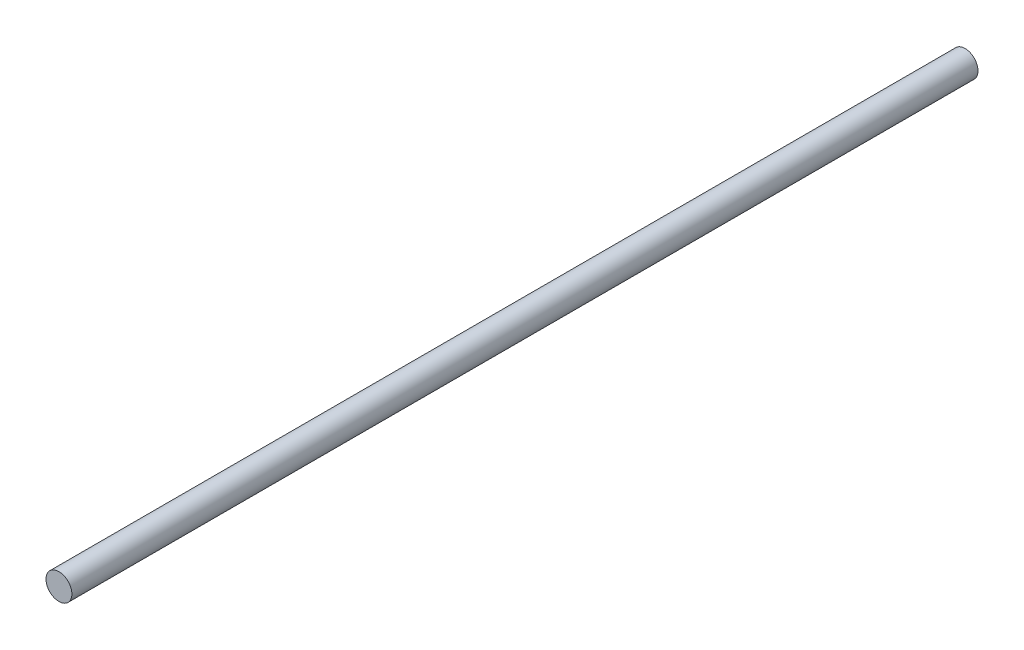
from build123d import *

# Parameters (mm, degrees)
SKETCH2_R           = 4
BOSS_EXTRUDE1_DEPTH = 280


with BuildPart() as part:
    # Sketch2 → Boss-Extrude1 (new body)
    with BuildSketch(Plane.XY):
        Circle(SKETCH2_R)
    extrude(amount=BOSS_EXTRUDE1_DEPTH)


solid = part.part
